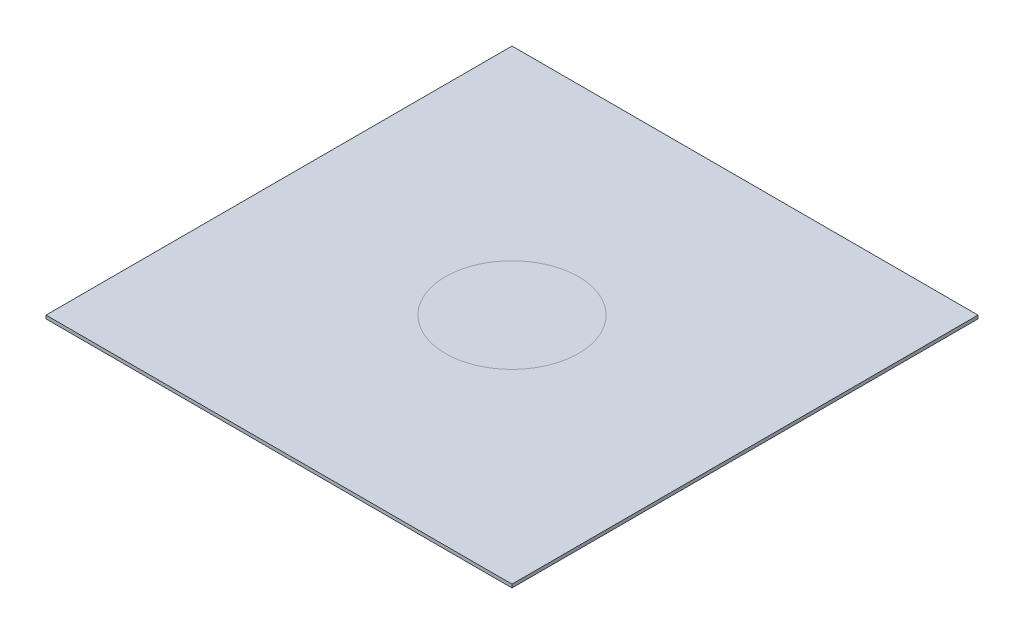
from build123d import *

# Parameters (mm, degrees)
SKETCH1_W           = 140
SKETCH1_H           = 140
BOSS_EXTRUDE1_DEPTH = 0.5


with BuildPart() as part:
    # Sketch1 → Boss-Extrude1 (new, symmetric)
    with BuildSketch(Plane(origin=(0, 0, 0), x_dir=(1, 0, 0), z_dir=(0, 1, 0))):
        Rectangle(SKETCH1_W, SKETCH1_H)
    extrude(amount=BOSS_EXTRUDE1_DEPTH, both=True)


solid = part.part
